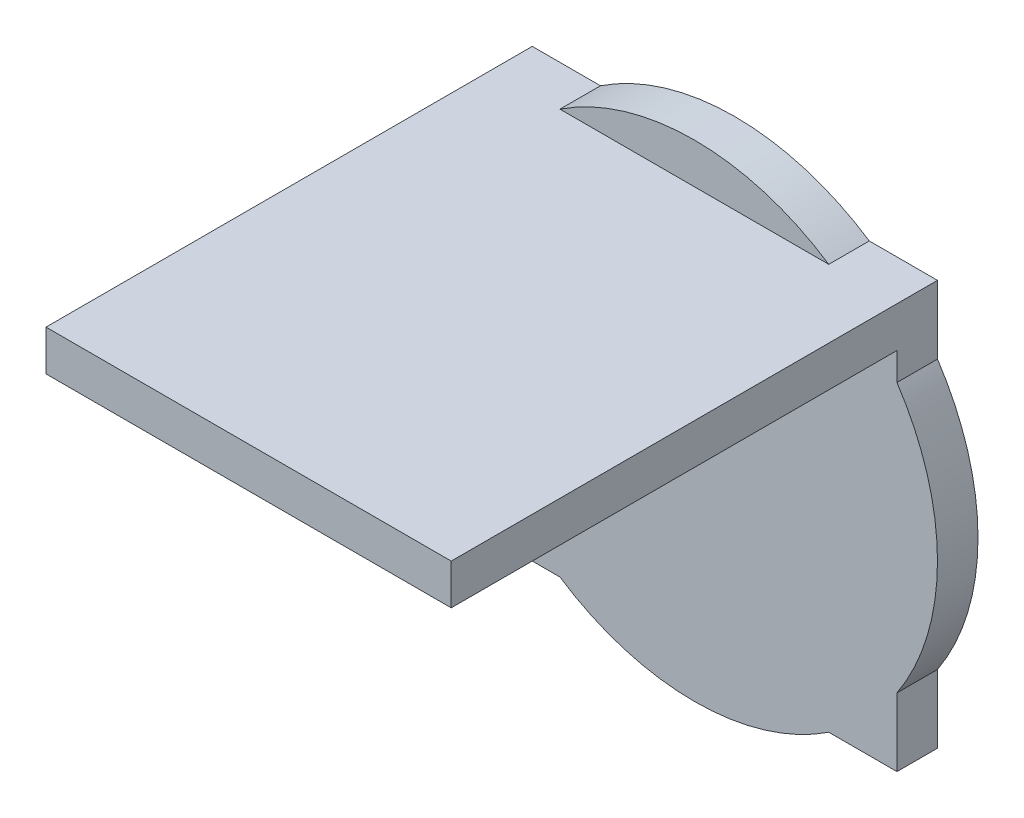
from build123d import *

# Parameters (mm, degrees)
SKETCH_1_R      = 300
EXTRUDE_1_DEPTH = 50
SKETCH_2_W      = 500
SKETCH_2_H      = 500
EXTRUDE_2_DEPTH = 50
SKETCH_3_W      = 500
SKETCH_3_H      = 50
EXTRUDE_3_DEPTH = 600


with BuildPart() as part:
    # 草图1 → 凸台-拉伸1 (new body)
    with BuildSketch(Plane.XY):
        Circle(SKETCH_1_R)
    extrude(amount=EXTRUDE_1_DEPTH)

    # 草图2 → 凸台-拉伸2 (add)
    with BuildSketch(Plane.XY):
        Rectangle(SKETCH_2_W, SKETCH_2_H)
    extrude(amount=EXTRUDE_2_DEPTH)

    # 草图3 → 凸台-拉伸3 (add)
    with BuildSketch(Plane.XY):
        with Locations((0, 225)):
            Rectangle(SKETCH_3_W, SKETCH_3_H)
    extrude(amount=EXTRUDE_3_DEPTH)


solid = part.part
